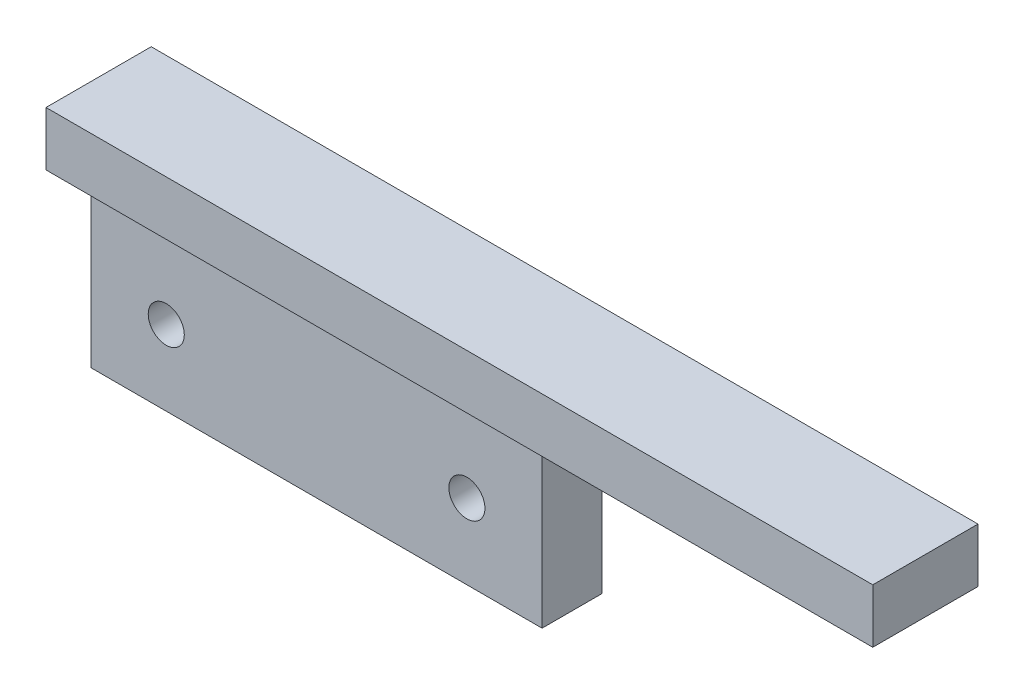
from build123d import *

# Parameters (mm, degrees)
SKETCH_1_W                   = 60
SKETCH_1_H                   = 25
EXTRUDE_1_DEPTH              = 8
EXTRUDE_2_DEPTH              = 6
EXTRUDE_2_DEPTH_BACK         = 8
SKETCH_2_W                   = 60
SKETCH_2_H                   = 8
CUT_EXTRUDE_1_DEPTH          = 65.932657423
CUT_EXTRUDE_1_DEPTH_BACK     = 65.932657423
SKETCH_3_W                   = 6
SKETCH_3_H                   = 0.8
HOLE_WIZARD_M4_1_D           = 4.8
HOLE_WIZARD_M4_1_DEPTH       = 10.1
HOLE_WIZARD_M4_1_CBORE_D     = 8
HOLE_WIZARD_M4_1_CBORE_DEPTH = 4
HOLE_WIZARD_M4_1_TIP         = 1.442065486
SKETCH_7_W                   = 14
SKETCH_7_H                   = 7.2
EXTRUDE_3_DEPTH              = 50


with BuildPart() as part:
    # 스케치1 → 보스-돌출1 (new body)
    with BuildSketch(Plane.XY):
        Rectangle(SKETCH_1_W, SKETCH_1_H)
    extrude(amount=EXTRUDE_1_DEPTH)

    # 스케치2 → 보스-돌출2 (add, two sides: drawn at the far end of the back side and taken through both)
    with BuildSketch(Plane.XY.offset(8).offset(-EXTRUDE_2_DEPTH_BACK)):
        with Locations((0, 16.5)):
            Rectangle(SKETCH_2_W, SKETCH_2_H)
    extrude(amount=EXTRUDE_2_DEPTH + EXTRUDE_2_DEPTH_BACK)

    # 스케치3 → 컷-돌출1 (cut, two sides: drawn at the far end of the back side and taken through both)
    with BuildSketch(Plane(origin=(30, 0, 0), x_dir=(0, 0, -1), z_dir=(1, 0, 0)).offset(-CUT_EXTRUDE_1_DEPTH_BACK)):
        with Locations((-11, 12.9)):
            Rectangle(SKETCH_3_W, SKETCH_3_H)
    extrude(amount=CUT_EXTRUDE_1_DEPTH + CUT_EXTRUDE_1_DEPTH_BACK, mode=Mode.SUBTRACT)

    # M4 소켓 머리 캡 나사용 카운터보어1
    with Locations(Plane(origin=(0, 0, 0), x_dir=(-1, 0, 0), z_dir=(0, 0, -1))):
        with Locations((-20, -2.5), (20, -2.5)):
            CounterBoreHole(HOLE_WIZARD_M4_1_D / 2, HOLE_WIZARD_M4_1_CBORE_D / 2, HOLE_WIZARD_M4_1_CBORE_DEPTH, depth=HOLE_WIZARD_M4_1_DEPTH)
            with Locations((0, 0, -(HOLE_WIZARD_M4_1_DEPTH + HOLE_WIZARD_M4_1_TIP / 2))):  # 118° drill point
                Cone(0, HOLE_WIZARD_M4_1_D / 2, HOLE_WIZARD_M4_1_TIP, mode=Mode.SUBTRACT)

    # 스케치7 → 보스-돌출3 (add)
    with BuildSketch(Plane.ZY.offset(-30)):
        with Locations((7, 16.9)):
            Rectangle(SKETCH_7_W, SKETCH_7_H)
    extrude(amount=-EXTRUDE_3_DEPTH)


solid = part.part
